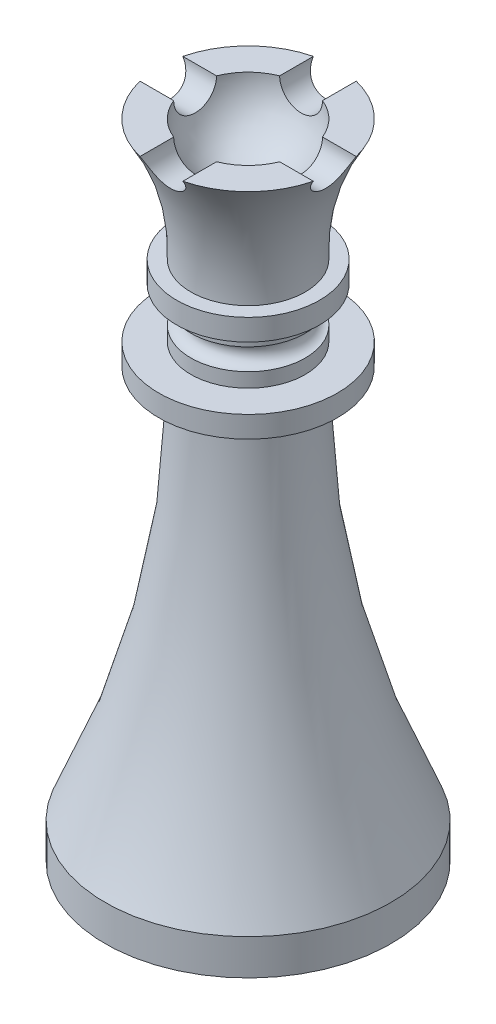
from build123d import *

# Parameters (mm, degrees)
CUT_EXTRUDE1_REACH            = 68.332
CUT_EXTRUDE1_END_MAJOR_RADIUS = 37.977551241
CUT_EXTRUDE1_END_MINOR_RADIUS = 30
SKETCH2_R                     = 3
CIRPATTERN1_COUNT             = 4
SCALE_1_SCALE                 = 0.6


with BuildPart() as part:
    # Sketch1 → Revolve1 (revolve)
    with BuildSketch(Plane.XY, mode=Mode.PRIVATE) as revolve1_sk:
        with BuildLine():
            Line((0, -60), (20, -60))
            Line((20, -60), (20, -55))
            ThreePointArc((20, -55), (11.206794692, -29.145390653), (8.008821921, -2.024287169))
            ThreePointArc((8.008821921, -2.024287169), (8.585899987, -0.594399477), (10.008674448, 0))
            Line((10.008674448, 0), (12.5, 0))
            Line((12.5, 0), (12.5, 3))
            Line((12.5, 3), (8, 3))
            Line((8, 3), (8, 5))
            ThreePointArc((8, 5), (6.5, 6.5), (8, 8))
            Line((8, 8), (8, 10))
            Line((8, 10), (10, 10))
            Line((10, 10), (10, 13))
            Line((10, 13), (8, 13))
            ThreePointArc((8, 13), (8.976394405, 21.837130893), (12.5, 30))
            Line((12.5, 30), (8, 30))
            ThreePointArc((8, 30), (5.656854249, 24.343145751), (0, 22))
            Line((0, 22), (0, -60))
        make_face()
    revolve(revolve1_sk.sketch.rotate(Axis((0, 0, 0), (0, 1, 0)), 90), axis=Axis((0, 0, 0), (0, 1, 0)))

    # Cut-Extrude1: up to this torus (the profile starts outside it)
    cut_extrude1_end = Plane(origin=(0, 14.160354083, 0), z_dir=(0, -1, 0)) * Torus(CUT_EXTRUDE1_END_MAJOR_RADIUS, CUT_EXTRUDE1_END_MINOR_RADIUS, mode=Mode.PRIVATE)
    # Sketch2 → Cut-Extrude1 (cut, up to the surface)
    with BuildSketch(Plane.XY, mode=Mode.PRIVATE) as cut_extrude1_sk1:
        with Locations((0, 30)):
            Circle(SKETCH2_R)
    cut_extrude1_tool1 = extrude(cut_extrude1_sk1.sketch, amount=-CUT_EXTRUDE1_REACH, mode=Mode.PRIVATE) - cut_extrude1_end
    cut_extrude1 = cut_extrude1_tool1.solids().sort_by_distance((0, 30, 0))[0]
    add(cut_extrude1, mode=Mode.SUBTRACT)

    # CirPattern1: Cut-Extrude1 ×4 about axis
    cirpattern1_axis = Axis((0, 13, 0), (0, -1, 0))
    for i in range(1, CIRPATTERN1_COUNT):
        add(cut_extrude1.rotate(cirpattern1_axis, i * 360 / CIRPATTERN1_COUNT), mode=Mode.SUBTRACT)


with BuildPart() as part_1:
    # 缩放比例1: scaled about (0, 0, 0)
    add(part.part.scale(SCALE_1_SCALE))


solid = part_1.part
